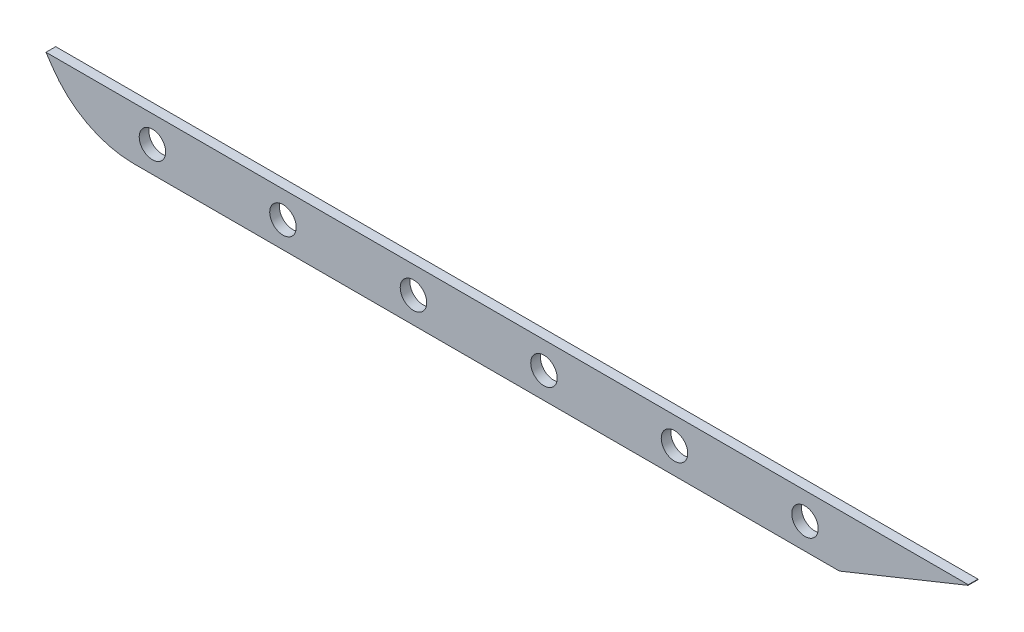
from build123d import *

# Parameters (mm, degrees)
BOSS_EXTRUDE1_DEPTH = 4.7625
SKETCH1_4_R         = 6.5
CUT_EXTRUDE1_DEPTH  = 439.920211962
FILLET1_R           = 48
CUT_EXTRUDE3_DEPTH  = 10
CUT_EXTRUDE5_DEPTH  = 10


with BuildPart() as part:
    # Sketch1 → Boss-Extrude1 (new body)
    with BuildSketch(Plane.XY):
        Polygon((428.120588235, 28.939617947), (0.540381846, 28.939617947), (-115.605170134, 28.939617947), (-98.879411765, 3.850980392), (-31.879411765, -96.649019608), (366, -96.649019608), (403.120588235, -71.149019608), align=None)
    extrude(amount=BOSS_EXTRUDE1_DEPTH)

    # Sketch1<4> → Cut-Extrude1 (cut, through all)
    with BuildSketch(Plane.XY):
        with Locations((3.120588235, -83.899019608)):
            Circle(SKETCH1_4_R)
        with Locations((67.120588235, -83.899019608)):
            Circle(SKETCH1_4_R)
        with Locations((131.120588235, -83.899019608)):
            Circle(SKETCH1_4_R)
        with Locations((195.120588235, -83.899019608)):
            Circle(SKETCH1_4_R)
        with Locations((259.120588235, -83.899019608)):
            Circle(SKETCH1_4_R)
        with Locations((323.120588235, -83.899019608)):
            Circle(SKETCH1_4_R)
    extrude(amount=CUT_EXTRUDE1_DEPTH, mode=Mode.SUBTRACT)

    # Fillet1
    fillet1_edges = [part.edges().sort_by_distance(p)[0] for p in [
        (-31.879411765, -96.649019608, 2.38125),
    ]]
    fillet(fillet1_edges, radius=FILLET1_R)

    # Sketch7 → Cut-Extrude3 (cut)
    with BuildSketch(Plane.XY.offset(4.7625)):
        Polygon((403.120588235, -71.149019608), (340.005873473, -96.649019608), (366, -96.649019608), align=None)
    extrude(amount=-CUT_EXTRUDE3_DEPTH, mode=Mode.SUBTRACT)

    # Sketch11 → Cut-Extrude5 (cut)
    with BuildSketch(Plane.XY.offset(4.7625)):
        Polygon((-49.086078431, -70.839019608), (403.198019602, -70.839019608), (428.120588235, 28.939617947), (-115.605170134, 28.939617947), align=None)
    extrude(amount=-CUT_EXTRUDE5_DEPTH, mode=Mode.SUBTRACT)


solid = part.part
